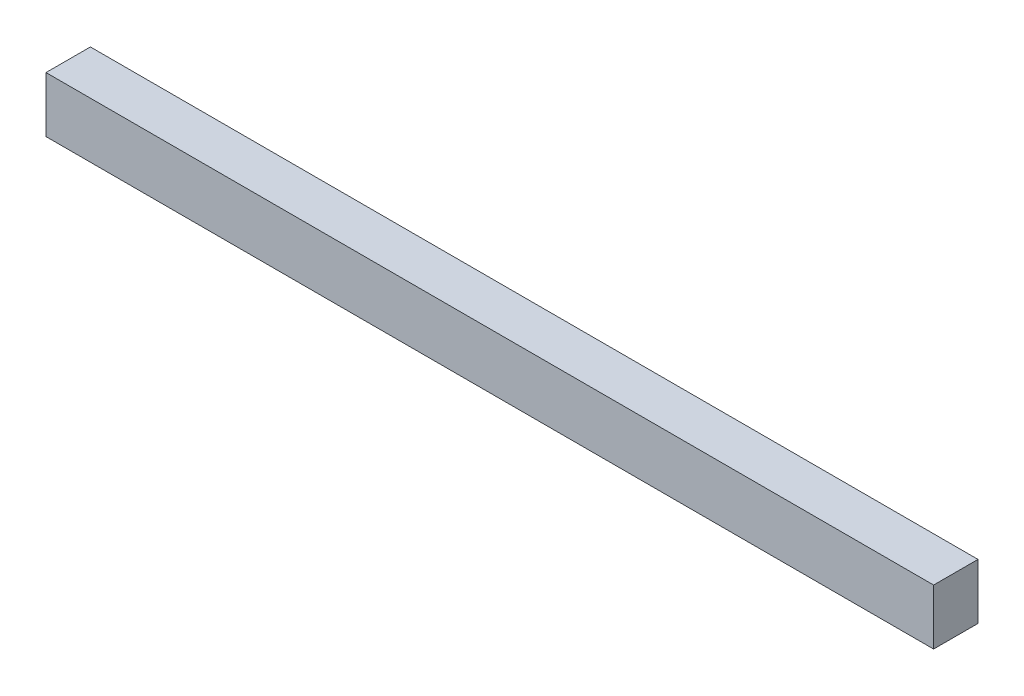
from build123d import *

# Parameters (mm, degrees)
SKETCH1_W           = 800
SKETCH1_H           = 40
BOSS_EXTRUDE1_DEPTH = 50


with BuildPart() as part:
    # Sketch1 → Boss-Extrude1 (new body)
    with BuildSketch(Plane(origin=(0, 0, 0), x_dir=(1, 0, 0), z_dir=(0, 1, 0))):
        Rectangle(SKETCH1_W, SKETCH1_H)
    extrude(amount=BOSS_EXTRUDE1_DEPTH)


solid = part.part
